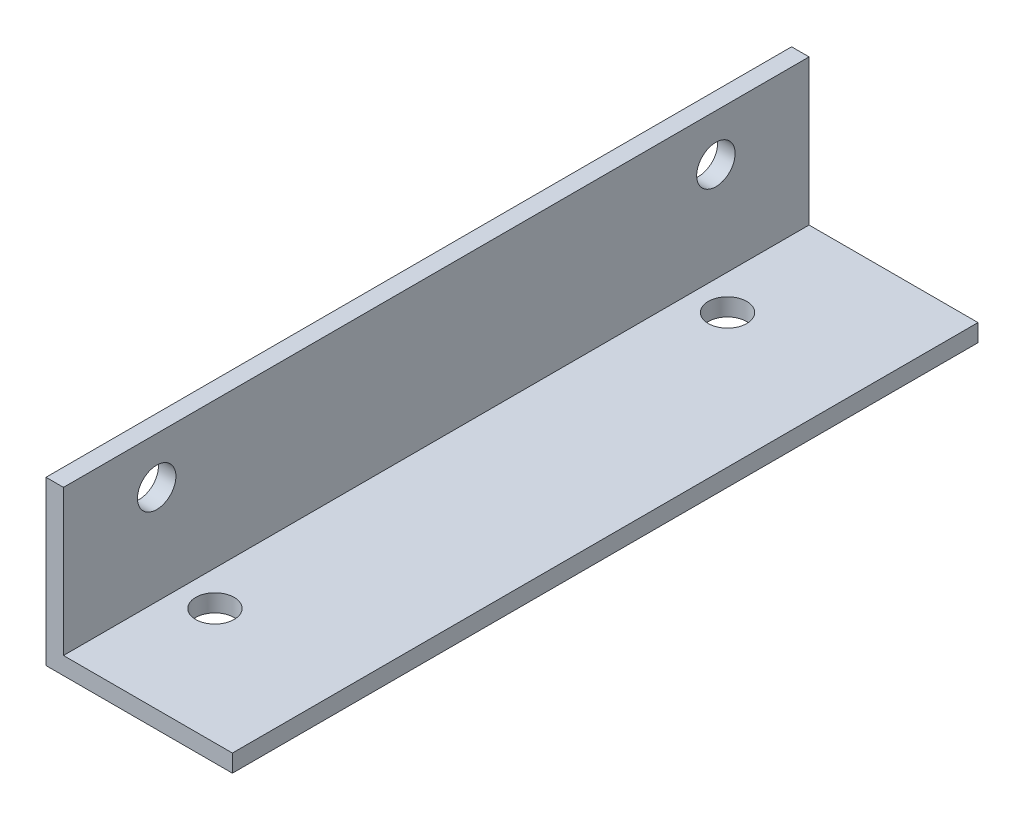
from build123d import *

# Parameters (mm, degrees)
F_1P5MM_64_START              = -32
F_1P5MM_64_DEPTH              = 64
CUT_EXTRUDE_M3_1_DEPTH        = 100
CUT_EXTRUDE_M3_1_DEPTH_BACK   = 100
SKETCH_2_R                    = 1.65
CUT_EXTRUDE_M3_1_2_DEPTH      = 100
CUT_EXTRUDE_M3_1_2_DEPTH_BACK = 100
SKETCH_3_R                    = 1.65
CUT_EXTRUDE_M3_1_3_DEPTH      = 100
CUT_EXTRUDE_M3_1_3_DEPTH_BACK = 100
SKETCH_4_R                    = 1.65
CUT_EXTRUDE_M3_1_4_DEPTH      = 100
CUT_EXTRUDE_M3_1_4_DEPTH_BACK = 100
SKETCH_5_R                    = 1.65


with BuildPart() as part:
    # 草图1 → 1p5mm铝合金直角座_宽64 (new body)
    with BuildSketch(Plane.XY.offset(F_1P5MM_64_START)):
        Polygon((0, 0), (16, 0), (16, 1.5), (1.5, 1.5), (1.5, 14), (0, 14), align=None)
    extrude(amount=F_1P5MM_64_DEPTH)

    # 草图2 → Cut-Extrude M3_-1 (cut, two sides: drawn at the far end of the back side and taken through both)
    with BuildSketch(Plane(origin=(0, 0, 0), x_dir=(0, 0, -1), z_dir=(1, 0, 0)).offset(-CUT_EXTRUDE_M3_1_DEPTH_BACK)):
        with Locations((24, 10)):
            Circle(SKETCH_2_R)
    extrude(amount=CUT_EXTRUDE_M3_1_DEPTH + CUT_EXTRUDE_M3_1_DEPTH_BACK, mode=Mode.SUBTRACT)

    # 草图3 → Cut-Extrude M3_-1 2 (cut, two sides: drawn at the far end of the back side and taken through both)
    with BuildSketch(Plane(origin=(0, 0, 0), x_dir=(1, 0, 0), z_dir=(0, 1, 0)).offset(-CUT_EXTRUDE_M3_1_2_DEPTH_BACK)):
        with Locations(Location((4.5, 22, 0), (0, 0, 270))):
            Circle(SKETCH_3_R)
    extrude(amount=CUT_EXTRUDE_M3_1_2_DEPTH + CUT_EXTRUDE_M3_1_2_DEPTH_BACK, mode=Mode.SUBTRACT)

    # 草图4 → Cut-Extrude M3_1 3 (cut, two sides: drawn at the far end of the back side and taken through both)
    with BuildSketch(Plane(origin=(0, 0, 0), x_dir=(0, 0, -1), z_dir=(1, 0, 0)).offset(-CUT_EXTRUDE_M3_1_3_DEPTH_BACK)):
        with Locations((-24, 10)):
            Circle(SKETCH_4_R)
    extrude(amount=CUT_EXTRUDE_M3_1_3_DEPTH + CUT_EXTRUDE_M3_1_3_DEPTH_BACK, mode=Mode.SUBTRACT)

    # 草图5 → Cut-Extrude M3_1 4 (cut, two sides: drawn at the far end of the back side and taken through both)
    with BuildSketch(Plane(origin=(0, 0, 0), x_dir=(1, 0, 0), z_dir=(0, 1, 0)).offset(-CUT_EXTRUDE_M3_1_4_DEPTH_BACK)):
        with Locations(Location((4.5, -22, 0), (0, 0, 270))):
            Circle(SKETCH_5_R)
    extrude(amount=CUT_EXTRUDE_M3_1_4_DEPTH + CUT_EXTRUDE_M3_1_4_DEPTH_BACK, mode=Mode.SUBTRACT)


solid = part.part
